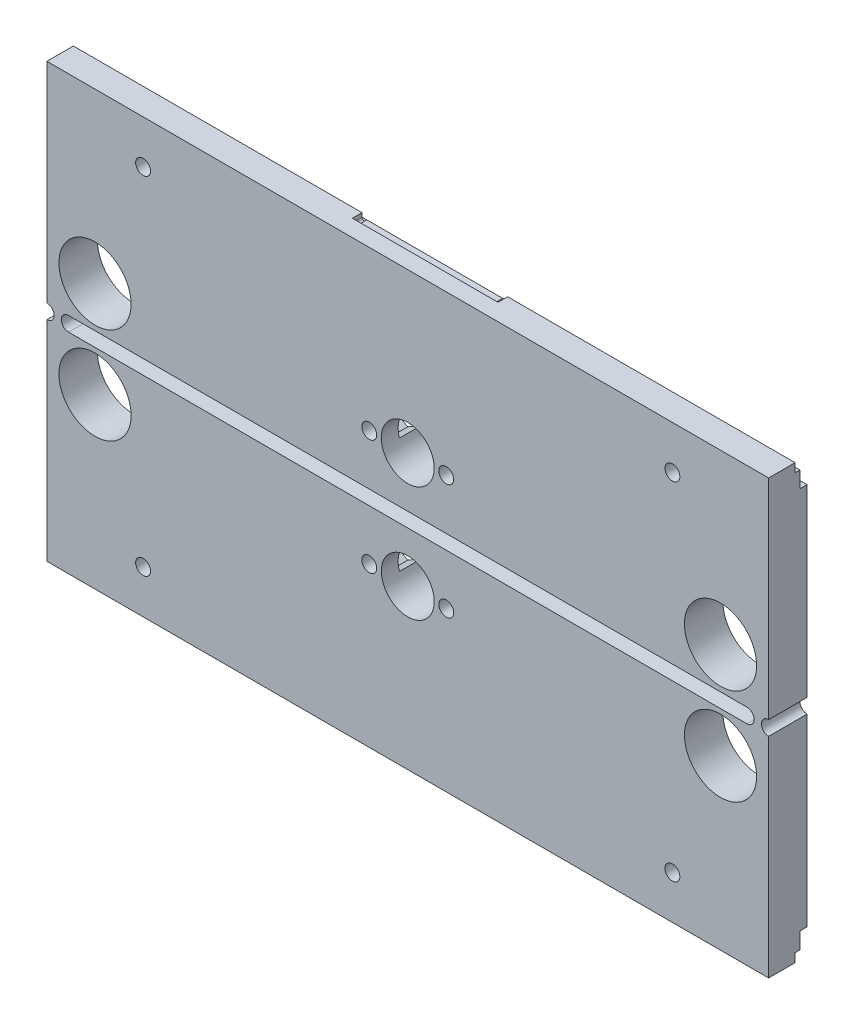
from build123d import *

# Parameters (mm, degrees)
SKETCH_2_W           = 150
SKETCH_2_H           = 43.5
SKETCH_2_R           = 7.5
SKETCH_2_R_2         = 4.05
EXTRUDE_1_DEPTH      = 8
CUT_EXTRUDE_2_DEPTH  = 157.38494173
SKETCH_5_R           = 1.55
CUT_EXTRUDE_3_DEPTH  = 157.38494173
SKETCH_20_R          = 5.5
CUT_EXTRUDE_17_DEPTH = 157.38494173
CUT_EXTRUDE_5_DEPTH  = 4.5
SKETCH_25_R          = 1.55
CUT_EXTRUDE_13_DEPTH = 157.38494173
CUT_EXTRUDE_11_DEPTH = 2
EXTRUDE_2_DEPTH      = 8


with BuildPart() as part:
    # 草图2 → 凸台-拉伸1 (new body)
    with BuildSketch(Plane.XY):
        with Locations((75, 21.75)):
            Rectangle(SKETCH_2_W, SKETCH_2_H)
        with Locations((10, 8.5)):
            Circle(SKETCH_2_R, mode=Mode.SUBTRACT)
        with Locations((75, 10.5)):
            Circle(SKETCH_2_R_2, mode=Mode.SUBTRACT)
        with Locations((140, 8.5)):
            Circle(SKETCH_2_R, mode=Mode.SUBTRACT)
    extrude_1 = extrude(amount=EXTRUDE_1_DEPTH)

    # 草图4 → 切除-拉伸2 (cut, through all)
    with BuildSketch(Plane(origin=(150, 0, 0), x_dir=(0, 0, -1), z_dir=(1, 0, 0))):
        Polygon((-1.5, 41.7), (-2.5, 41.7), (-2.5, 43.5), (0, 43.5), (0, 38.3), (-1.5, 38.3), align=None)
    cut_extrude_2 = extrude(amount=-CUT_EXTRUDE_2_DEPTH, mode=Mode.SUBTRACT)

    # 草图5 → 切除-拉伸3 (cut, through all)
    with BuildSketch(Plane.XY.offset(8)):
        with Locations((83, 10.5)):
            Circle(SKETCH_5_R)
        with Locations((67, 10.5)):
            Circle(SKETCH_5_R)
    cut_extrude_3 = extrude(amount=-CUT_EXTRUDE_3_DEPTH, mode=Mode.SUBTRACT)

    # 草图20 → 切除-拉伸17 (cut, through all)
    with BuildSketch(Plane(origin=(0, 0, 0), x_dir=(-1, 0, 0), z_dir=(0, 0, -1))):
        with Locations((-75, 10.5)):
            Circle(SKETCH_20_R)
    cut_extrude_17 = extrude(amount=-CUT_EXTRUDE_17_DEPTH, mode=Mode.SUBTRACT)

    # 草图8 → 切除-拉伸5 (cut)
    with BuildSketch(Plane(origin=(0, 0, 0), x_dir=(-1, 0, 0), z_dir=(0, 0, -1))):
        Polygon((-80.15, 8.854551733), (-80.15, 12.145448267), (-83, 13.790896534), (-85.85, 12.145448267), (-85.85, 8.854551733), (-83, 7.209103466), align=None)
        Polygon((-64.15, 8.854551733), (-64.15, 12.145448267), (-67, 13.790896534), (-69.85, 12.145448267), (-69.85, 8.854551733), (-67, 7.209103466), align=None)
    cut_extrude_5 = extrude(amount=-CUT_EXTRUDE_5_DEPTH, mode=Mode.SUBTRACT)

    # 草图25 → 切除-拉伸13 (cut, through all)
    with BuildSketch(Plane(origin=(0, 0, 0), x_dir=(-1, 0, 0), z_dir=(0, 0, -1))):
        with Locations((-130, 34.5)):
            Circle(SKETCH_25_R)
        with Locations((-20, 34.5)):
            Circle(SKETCH_25_R)
    cut_extrude_13 = extrude(amount=-CUT_EXTRUDE_13_DEPTH, mode=Mode.SUBTRACT)

    # 草图19 → 切除-拉伸11 (cut)
    with BuildSketch(Plane(origin=(0, 0, 2.5), x_dir=(-1, 0, 0), z_dir=(0, 0, -1))):
        with BuildLine():
            Line((-60, 43.5), (-90.247938178, 43.5))
            Line((-90.247938178, 43.5), (-90.247938178, 42.7))
            ThreePointArc((-90.247938178, 42.7), (-89.747938178, 42.2), (-89.247938178, 42.7))
            Line((-89.247938178, 42.7), (-61, 42.7))
            ThreePointArc((-61, 42.7), (-60.5, 42.2), (-60, 42.7))
            Line((-60, 42.7), (-60, 43.5))
        make_face()
    cut_extrude_11 = extrude(amount=-CUT_EXTRUDE_11_DEPTH, mode=Mode.SUBTRACT)

    # 草图22 → 凸台-拉伸2 (add)
    with BuildSketch(Plane.XY.offset(8)):
        with BuildLine():
            Line((0, -3), (4.5, -3))
            ThreePointArc((4.5, -3), (3, -1.5), (4.5, 0))
            Line((4.5, 0), (0, 0))
            ThreePointArc((0, 0), (1.5, -1.5), (0, -3))
        make_face()
        with BuildLine():
            Line((150, 0), (145.5, 0))
            ThreePointArc((145.5, 0), (147, -1.5), (145.5, -3))
            Line((145.5, -3), (150, -3))
            ThreePointArc((150, -3), (148.5, -1.5), (150, 0))
        make_face()
    extrude(amount=-EXTRUDE_2_DEPTH)

    # 镜向2: 凸台-拉伸1, 切除-拉伸2, 切除-拉伸3, 切除-拉伸17, 切除-拉伸5, 切除-拉伸13, 切除-拉伸11 across plane
    add(extrude_1.mirror(Plane(origin=(0, -1.5, 0), x_dir=(0, 0, 1), z_dir=(0, -1, 0))))
    add(cut_extrude_2.mirror(Plane(origin=(0, -1.5, 0), x_dir=(0, 0, 1), z_dir=(0, -1, 0))), mode=Mode.SUBTRACT)
    add(cut_extrude_3.mirror(Plane(origin=(0, -1.5, 0), x_dir=(0, 0, 1), z_dir=(0, -1, 0))), mode=Mode.SUBTRACT)
    add(cut_extrude_17.mirror(Plane(origin=(0, -1.5, 0), x_dir=(0, 0, 1), z_dir=(0, -1, 0))), mode=Mode.SUBTRACT)
    add(cut_extrude_5.mirror(Plane(origin=(0, -1.5, 0), x_dir=(0, 0, 1), z_dir=(0, -1, 0))), mode=Mode.SUBTRACT)
    add(cut_extrude_13.mirror(Plane(origin=(0, -1.5, 0), x_dir=(0, 0, 1), z_dir=(0, -1, 0))), mode=Mode.SUBTRACT)
    add(cut_extrude_11.mirror(Plane(origin=(0, -1.5, 0), x_dir=(0, 0, 1), z_dir=(0, -1, 0))), mode=Mode.SUBTRACT)


solid = part.part
